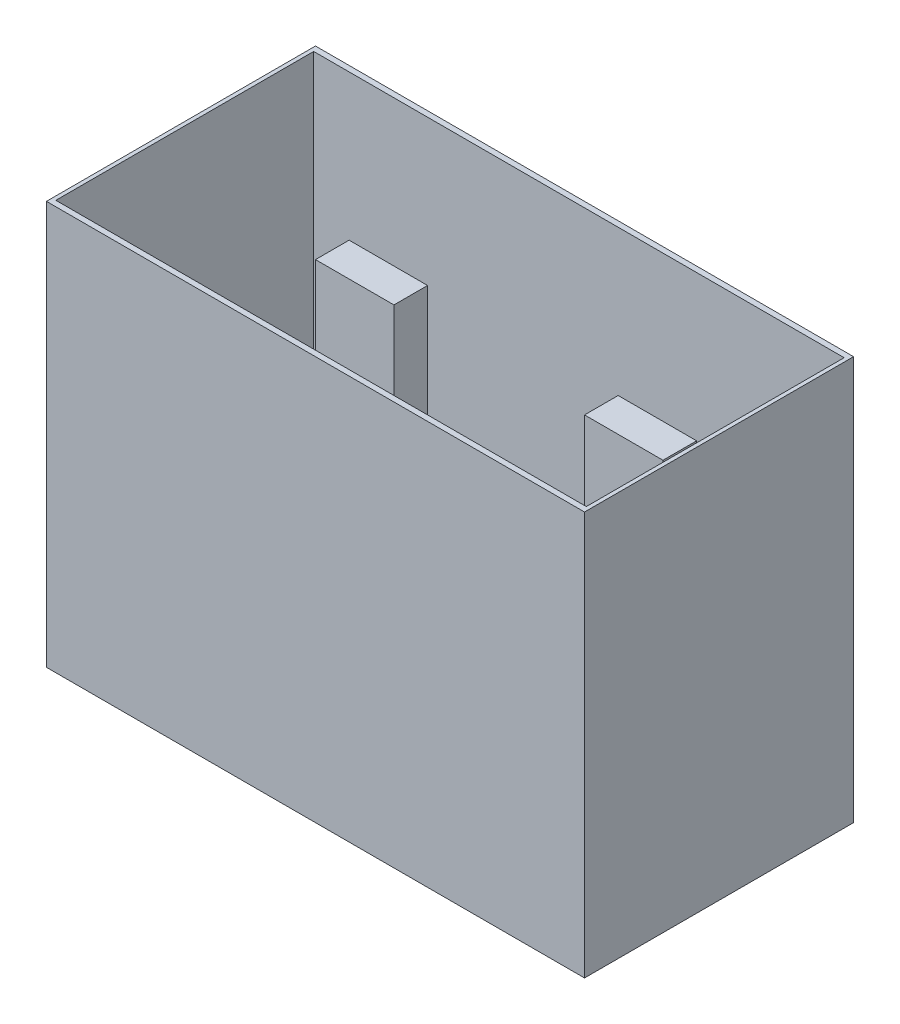
from build123d import *

# Parameters (mm, degrees)
SKETCH1_W                 = 584.2
SKETCH1_H                 = 279.4
BOSS_EXTRUDE1_DEPTH       = 6.35
SKETCH2_W                 = 88.9
SKETCH2_H                 = 38.1
BOSS_EXTRUDE2_DEPTH       = 304.8
LPATTERN1_COUNT           = 2
LPATTERN1_PITCH           = 304.8
LPATTERN2_COUNT           = 2
LPATTERN2_PITCH           = 215.9
LPATTERN2_COPY_1_SKETCH_W = 88.9
LPATTERN2_COPY_1_SKETCH_H = 38.1
LPATTERN2_COPY_1_DEPTH    = 304.8
SKETCH3_W                 = 609.6
SKETCH3_H                 = 304.8
SKETCH3_W_2               = 600.964
SKETCH3_H_2               = 292.1
BOSS_EXTRUDE3_DEPTH       = 457.2


with BuildPart() as part:
    # Sketch1 → Boss-Extrude1 (new body)
    with BuildSketch(Plane(origin=(0, 0, 0), x_dir=(1, 0, 0), z_dir=(0, 1, 0))):
        Rectangle(SKETCH1_W, SKETCH1_H)
    extrude(amount=BOSS_EXTRUDE1_DEPTH)

    # Sketch2 → Boss-Extrude2 (add)
    with BuildSketch(Plane(origin=(0, 6.35, 0), x_dir=(1, 0, 0), z_dir=(0, 1, 0))):
        with Locations((-196.85, -107.95)):
            Rectangle(SKETCH2_W, SKETCH2_H)
    boss_extrude2 = extrude(amount=BOSS_EXTRUDE2_DEPTH)

    # LPattern1: Boss-Extrude2 ×2
    with Locations(*[(i * LPATTERN1_PITCH, 0, 0) for i in range(1, LPATTERN1_COUNT)]):
        add(boss_extrude2)

    # LPattern2: Boss-Extrude2 ×2
    with Locations(*[(0, 0, -i * LPATTERN2_PITCH) for i in range(1, LPATTERN2_COUNT)]):
        add(boss_extrude2)

    # LPattern2 copy 1 sketch → LPattern2 copy 1 (add)
    with BuildSketch(Plane(origin=(304.8, 6.35, -215.9), x_dir=(1, 0, 0), z_dir=(0, 1, 0))):
        with Locations((-196.85, -107.95)):
            Rectangle(LPATTERN2_COPY_1_SKETCH_W, LPATTERN2_COPY_1_SKETCH_H)
    extrude(amount=LPATTERN2_COPY_1_DEPTH)


with BuildPart() as body_2:
    # Sketch3 → Boss-Extrude3 (new body)
    with BuildSketch(Plane(origin=(0, 0, 0), x_dir=(1, 0, 0), z_dir=(0, 1, 0))):
        Rectangle(SKETCH3_W, SKETCH3_H)
        Rectangle(SKETCH3_W_2, SKETCH3_H_2, mode=Mode.SUBTRACT)
    extrude(amount=BOSS_EXTRUDE3_DEPTH)


solid = Compound([part.part, body_2.part])
